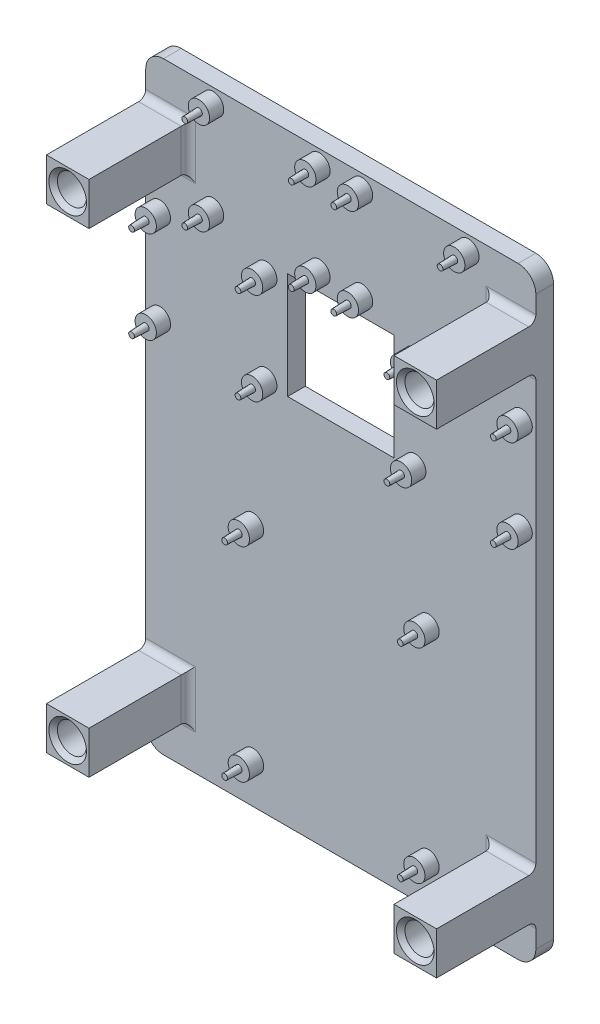
from build123d import *

# Parameters (mm, degrees)
SKIZZE1_W                                  = 110
SKIZZE1_H                                  = 170
AUFSATZ_LINEAR_AUSTRAGEN1_DEPTH            = 5
VERRUNDUNG1_R                              = 5
SKIZZE7_W                                  = 12
SKIZZE7_H                                  = 12
AUFSATZ_LINEAR_AUSTRAGEN3_DEPTH            = 28
VERRUNDUNG2_R                              = 2
SKIZZE8_R                                  = 4.1
SCHNITT_LINEAR_AUSTRAGEN3_DEPTH            = 107.484740691
LINEARES_MUSTER1_COUNT                     = 2
LINEARES_MUSTER1_PITCH                     = 134
LINEARES_MUSTER1_COUNT_DIR2                = 2
LINEARES_MUSTER1_PITCH_DIR2                = 98
SKIZZE9_R                                  = 3
AUFSATZ_LINEAR_AUSTRAGEN4_DEPTH            = 4
SKIZZE10_R                                 = 0.95
AUFSATZ_LINEAR_AUSTRAGEN5_DEPTH            = 4
AUFSATZ_LINEAR_AUSTRAGEN5_DRAFT            = 2
AUFSATZ_LINEAR_AUSTRAGEN5_PROFILE_2_DEPTH  = 4
AUFSATZ_LINEAR_AUSTRAGEN5_PROFILE_2_DRAFT  = 2
AUFSATZ_LINEAR_AUSTRAGEN5_PROFILE_3_DEPTH  = 4
AUFSATZ_LINEAR_AUSTRAGEN5_PROFILE_3_DRAFT  = 2
AUFSATZ_LINEAR_AUSTRAGEN5_PROFILE_4_DEPTH  = 4
AUFSATZ_LINEAR_AUSTRAGEN5_PROFILE_4_DRAFT  = 2
AUFSATZ_LINEAR_AUSTRAGEN5_PROFILE_5_DEPTH  = 4
AUFSATZ_LINEAR_AUSTRAGEN5_PROFILE_5_DRAFT  = 2
AUFSATZ_LINEAR_AUSTRAGEN5_PROFILE_6_DEPTH  = 4
AUFSATZ_LINEAR_AUSTRAGEN5_PROFILE_6_DRAFT  = 2
AUFSATZ_LINEAR_AUSTRAGEN5_PROFILE_7_DEPTH  = 4
AUFSATZ_LINEAR_AUSTRAGEN5_PROFILE_7_DRAFT  = 2
AUFSATZ_LINEAR_AUSTRAGEN5_PROFILE_8_DEPTH  = 4
AUFSATZ_LINEAR_AUSTRAGEN5_PROFILE_8_DRAFT  = 2
AUFSATZ_LINEAR_AUSTRAGEN5_PROFILE_9_DEPTH  = 4
AUFSATZ_LINEAR_AUSTRAGEN5_PROFILE_9_DRAFT  = 2
AUFSATZ_LINEAR_AUSTRAGEN5_PROFILE_10_DEPTH = 4
AUFSATZ_LINEAR_AUSTRAGEN5_PROFILE_10_DRAFT = 2
AUFSATZ_LINEAR_AUSTRAGEN5_PROFILE_11_DEPTH = 4
AUFSATZ_LINEAR_AUSTRAGEN5_PROFILE_11_DRAFT = 2
AUFSATZ_LINEAR_AUSTRAGEN5_PROFILE_12_DEPTH = 4
AUFSATZ_LINEAR_AUSTRAGEN5_PROFILE_12_DRAFT = 2
AUFSATZ_LINEAR_AUSTRAGEN5_PROFILE_13_DEPTH = 4
AUFSATZ_LINEAR_AUSTRAGEN5_PROFILE_13_DRAFT = 2
AUFSATZ_LINEAR_AUSTRAGEN5_PROFILE_14_DEPTH = 4
AUFSATZ_LINEAR_AUSTRAGEN5_PROFILE_14_DRAFT = 2
AUFSATZ_LINEAR_AUSTRAGEN5_PROFILE_15_DEPTH = 4
AUFSATZ_LINEAR_AUSTRAGEN5_PROFILE_15_DRAFT = 2
AUFSATZ_LINEAR_AUSTRAGEN5_PROFILE_16_DEPTH = 4
AUFSATZ_LINEAR_AUSTRAGEN5_PROFILE_16_DRAFT = 2
AUFSATZ_LINEAR_AUSTRAGEN5_PROFILE_17_DEPTH = 4
AUFSATZ_LINEAR_AUSTRAGEN5_PROFILE_17_DRAFT = 2
AUFSATZ_LINEAR_AUSTRAGEN5_PROFILE_18_DEPTH = 4
AUFSATZ_LINEAR_AUSTRAGEN5_PROFILE_18_DRAFT = 2
AUFSATZ_LINEAR_AUSTRAGEN5_PROFILE_19_DEPTH = 4
AUFSATZ_LINEAR_AUSTRAGEN5_PROFILE_19_DRAFT = 2
AUFSATZ_LINEAR_AUSTRAGEN5_PROFILE_20_DEPTH = 4
AUFSATZ_LINEAR_AUSTRAGEN5_PROFILE_20_DRAFT = 2
FASE1_SIZE                                 = 1.2
SKIZZE11_W                                 = 30
SKIZZE11_H                                 = 30
SCHNITT_LINEAR_AUSTRAGEN4_DEPTH            = 106.0428484


with BuildPart() as part:
    # Skizze1 → Aufsatz-Linear austragen1 (new body)
    with BuildSketch(Plane.XY):
        Rectangle(SKIZZE1_W, SKIZZE1_H)
    extrude(amount=AUFSATZ_LINEAR_AUSTRAGEN1_DEPTH)

    # Verrundung1
    verrundung1_edges = [part.edges().sort_by_distance(p)[0] for p in [
        (55, -85, 2.5),
        (-55, -85, 2.5),
        (-55, 85, 2.5),
        (55, 85, 2.5),
    ]]
    fillet(verrundung1_edges, radius=VERRUNDUNG1_R)

    # Skizze7 → Aufsatz-Linear austragen3 (add)
    with BuildSketch(Plane.XY.offset(5)):
        with Locations((-49, 67)):
            Rectangle(SKIZZE7_W, SKIZZE7_H)
        with Locations((49, 67)):
            Rectangle(SKIZZE7_W, SKIZZE7_H)
        with Locations((49, -67)):
            Rectangle(SKIZZE7_W, SKIZZE7_H)
        with Locations((-49, -67)):
            Rectangle(SKIZZE7_W, SKIZZE7_H)
    extrude(amount=AUFSATZ_LINEAR_AUSTRAGEN3_DEPTH)

    # Verrundung2
    verrundung2_edges = [part.edges().sort_by_distance(p)[0] for p in [
        (-49, 61, 5),
        (-43, 67, 5),
        (-49, 73, 5),
        (49, 73, 5),
        (43, 67, 5),
        (49, 61, 5),
        (49, -61, 5),
        (43, -67, 5),
        (49, -73, 5),
        (-49, -73, 5),
        (-43, -67, 5),
        (-49, -61, 5),
    ]]
    fillet(verrundung2_edges, radius=VERRUNDUNG2_R)

    # Skizze8 → Schnitt-Linear austragen3 (cut, through all)
    with BuildSketch(Plane.XY.offset(33)):
        with Locations((-49, 67)):
            Circle(SKIZZE8_R)
    schnitt_linear_austragen3 = extrude(amount=-SCHNITT_LINEAR_AUSTRAGEN3_DEPTH, mode=Mode.SUBTRACT)

    # Lineares Muster1: Schnitt-Linear austragen3 2 × 2
    with Locations(*[(j * LINEARES_MUSTER1_PITCH_DIR2, -i * LINEARES_MUSTER1_PITCH, 0) for i in range(LINEARES_MUSTER1_COUNT) for j in range(LINEARES_MUSTER1_COUNT_DIR2) if (i, j) != (0, 0)]):
        add(schnitt_linear_austragen3, mode=Mode.SUBTRACT)

    # Skizze9 → Aufsatz-Linear austragen4 (add)
    with BuildSketch(Plane.XY.offset(5)):
        with Locations(Location((24.75, -73.75, 0), (0, 0, 180))):
            Circle(SKIZZE9_R)
        with Locations(Location((24.75, -16.25, 0), (0, 0, 180))):
            Circle(SKIZZE9_R)
        with Locations(Location((-24.75, -16.25, 0), (0, 0, 180))):
            Circle(SKIZZE9_R)
        with Locations(Location((-24.75, -73.75, 0), (0, 0, 180))):
            Circle(SKIZZE9_R)
        with Locations(Location((-36, 81, 0), (0, 0, 180))):
            Circle(SKIZZE9_R)
        with Locations(Location((-6, 81, 0), (0, 0, 180))):
            Circle(SKIZZE9_R)
        with Locations(Location((-36, 55, 0), (0, 0, 180))):
            Circle(SKIZZE9_R)
        with Locations(Location((-6, 55, 0), (0, 0, 180))):
            Circle(SKIZZE9_R)
        with Locations(Location((6, 81, 0), (0, 0, 180))):
            Circle(SKIZZE9_R)
        with Locations(Location((36, 81, 0), (0, 0, 180))):
            Circle(SKIZZE9_R)
        with Locations(Location((36, 55, 0), (0, 0, 180))):
            Circle(SKIZZE9_R)
        with Locations(Location((6, 55, 0), (0, 0, 180))):
            Circle(SKIZZE9_R)
        with Locations(Location((21, 47, 0), (0, 0, 180))):
            Circle(SKIZZE9_R)
        with Locations(Location((51, 47, 0), (0, 0, 180))):
            Circle(SKIZZE9_R)
        with Locations(Location((51, 21, 0), (0, 0, 180))):
            Circle(SKIZZE9_R)
        with Locations(Location((21, 21, 0), (0, 0, 180))):
            Circle(SKIZZE9_R)
        with Locations(Location((-21, 47, 0), (0, 0, 180))):
            Circle(SKIZZE9_R)
        with Locations(Location((-51, 47, 0), (0, 0, 180))):
            Circle(SKIZZE9_R)
        with Locations(Location((-51, 21, 0), (0, 0, 180))):
            Circle(SKIZZE9_R)
        with Locations(Location((-21, 21, 0), (0, 0, 180))):
            Circle(SKIZZE9_R)
    extrude(amount=AUFSATZ_LINEAR_AUSTRAGEN4_DEPTH)


with BuildPart() as aufsatz_linear_austragen5_tool:
    # Skizze10 → Aufsatz-Linear austragen5 (with draft: the straight prism first)
    with BuildSketch(Plane.XY.offset(9)):
        with Locations((24.75, -73.75)):
            Circle(SKIZZE10_R)
    extrude(amount=AUFSATZ_LINEAR_AUSTRAGEN5_DEPTH)
    # Aufsatz-Linear austragen5: the draft: its side faces are tilted about the plane it starts from
    aufsatz_linear_austragen5_sides = [aufsatz_linear_austragen5_tool.faces().sort_by_distance(p)[0] for p in [
        (23.8, -73.75, 11),
    ]]
    draft(aufsatz_linear_austragen5_sides, Plane.XY.offset(9), AUFSATZ_LINEAR_AUSTRAGEN5_DRAFT)


with BuildPart() as part_1:
    add(part.part)

    # Aufsatz-Linear austragen5: add aufsatz_linear_austragen5_tool
    add(aufsatz_linear_austragen5_tool.part)


with BuildPart() as aufsatz_linear_austragen5_profile_2_tool:
    # Skizze10 → Aufsatz-Linear austragen5 profile 2 (with draft: the straight prism first)
    with BuildSketch(Plane.XY.offset(9)):
        with Locations((24.75, -16.25)):
            Circle(SKIZZE10_R)
    extrude(amount=AUFSATZ_LINEAR_AUSTRAGEN5_PROFILE_2_DEPTH)
    # Aufsatz-Linear austragen5 profile 2: the draft: its side faces are tilted about the plane it starts from
    aufsatz_linear_austragen5_profile_2_sides = [aufsatz_linear_austragen5_profile_2_tool.faces().sort_by_distance(p)[0] for p in [
        (23.8, -16.25, 11),
    ]]
    draft(aufsatz_linear_austragen5_profile_2_sides, Plane.XY.offset(9), AUFSATZ_LINEAR_AUSTRAGEN5_PROFILE_2_DRAFT)


with BuildPart() as part_2:
    add(part_1.part)

    # Aufsatz-Linear austragen5 profile 2: add aufsatz_linear_austragen5_profile_2_tool
    add(aufsatz_linear_austragen5_profile_2_tool.part)


with BuildPart() as aufsatz_linear_austragen5_profile_3_tool:
    # Skizze10 → Aufsatz-Linear austragen5 profile 3 (with draft: the straight prism first)
    with BuildSketch(Plane.XY.offset(9)):
        with Locations((-24.75, -16.25)):
            Circle(SKIZZE10_R)
    extrude(amount=AUFSATZ_LINEAR_AUSTRAGEN5_PROFILE_3_DEPTH)
    # Aufsatz-Linear austragen5 profile 3: the draft: its side faces are tilted about the plane it starts from
    aufsatz_linear_austragen5_profile_3_sides = [aufsatz_linear_austragen5_profile_3_tool.faces().sort_by_distance(p)[0] for p in [
        (-25.7, -16.25, 11),
    ]]
    draft(aufsatz_linear_austragen5_profile_3_sides, Plane.XY.offset(9), AUFSATZ_LINEAR_AUSTRAGEN5_PROFILE_3_DRAFT)


with BuildPart() as part_3:
    add(part_2.part)

    # Aufsatz-Linear austragen5 profile 3: add aufsatz_linear_austragen5_profile_3_tool
    add(aufsatz_linear_austragen5_profile_3_tool.part)


with BuildPart() as aufsatz_linear_austragen5_profile_4_tool:
    # Skizze10 → Aufsatz-Linear austragen5 profile 4 (with draft: the straight prism first)
    with BuildSketch(Plane.XY.offset(9)):
        with Locations((-24.75, -73.75)):
            Circle(SKIZZE10_R)
    extrude(amount=AUFSATZ_LINEAR_AUSTRAGEN5_PROFILE_4_DEPTH)
    # Aufsatz-Linear austragen5 profile 4: the draft: its side faces are tilted about the plane it starts from
    aufsatz_linear_austragen5_profile_4_sides = [aufsatz_linear_austragen5_profile_4_tool.faces().sort_by_distance(p)[0] for p in [
        (-25.7, -73.75, 11),
    ]]
    draft(aufsatz_linear_austragen5_profile_4_sides, Plane.XY.offset(9), AUFSATZ_LINEAR_AUSTRAGEN5_PROFILE_4_DRAFT)


with BuildPart() as part_4:
    add(part_3.part)

    # Aufsatz-Linear austragen5 profile 4: add aufsatz_linear_austragen5_profile_4_tool
    add(aufsatz_linear_austragen5_profile_4_tool.part)


with BuildPart() as aufsatz_linear_austragen5_profile_5_tool:
    # Skizze10 → Aufsatz-Linear austragen5 profile 5 (with draft: the straight prism first)
    with BuildSketch(Plane.XY.offset(9)):
        with Locations((-51, 47)):
            Circle(SKIZZE10_R)
    extrude(amount=AUFSATZ_LINEAR_AUSTRAGEN5_PROFILE_5_DEPTH)
    # Aufsatz-Linear austragen5 profile 5: the draft: its side faces are tilted about the plane it starts from
    aufsatz_linear_austragen5_profile_5_sides = [aufsatz_linear_austragen5_profile_5_tool.faces().sort_by_distance(p)[0] for p in [
        (-51.95, 47, 11),
    ]]
    draft(aufsatz_linear_austragen5_profile_5_sides, Plane.XY.offset(9), AUFSATZ_LINEAR_AUSTRAGEN5_PROFILE_5_DRAFT)


with BuildPart() as part_5:
    add(part_4.part)

    # Aufsatz-Linear austragen5 profile 5: add aufsatz_linear_austragen5_profile_5_tool
    add(aufsatz_linear_austragen5_profile_5_tool.part)


with BuildPart() as aufsatz_linear_austragen5_profile_6_tool:
    # Skizze10 → Aufsatz-Linear austragen5 profile 6 (with draft: the straight prism first)
    with BuildSketch(Plane.XY.offset(9)):
        with Locations((-51, 21)):
            Circle(SKIZZE10_R)
    extrude(amount=AUFSATZ_LINEAR_AUSTRAGEN5_PROFILE_6_DEPTH)
    # Aufsatz-Linear austragen5 profile 6: the draft: its side faces are tilted about the plane it starts from
    aufsatz_linear_austragen5_profile_6_sides = [aufsatz_linear_austragen5_profile_6_tool.faces().sort_by_distance(p)[0] for p in [
        (-51.95, 21, 11),
    ]]
    draft(aufsatz_linear_austragen5_profile_6_sides, Plane.XY.offset(9), AUFSATZ_LINEAR_AUSTRAGEN5_PROFILE_6_DRAFT)


with BuildPart() as part_6:
    add(part_5.part)

    # Aufsatz-Linear austragen5 profile 6: add aufsatz_linear_austragen5_profile_6_tool
    add(aufsatz_linear_austragen5_profile_6_tool.part)


with BuildPart() as aufsatz_linear_austragen5_profile_7_tool:
    # Skizze10 → Aufsatz-Linear austragen5 profile 7 (with draft: the straight prism first)
    with BuildSketch(Plane.XY.offset(9)):
        with Locations((-21, 21)):
            Circle(SKIZZE10_R)
    extrude(amount=AUFSATZ_LINEAR_AUSTRAGEN5_PROFILE_7_DEPTH)
    # Aufsatz-Linear austragen5 profile 7: the draft: its side faces are tilted about the plane it starts from
    aufsatz_linear_austragen5_profile_7_sides = [aufsatz_linear_austragen5_profile_7_tool.faces().sort_by_distance(p)[0] for p in [
        (-21.95, 21, 11),
    ]]
    draft(aufsatz_linear_austragen5_profile_7_sides, Plane.XY.offset(9), AUFSATZ_LINEAR_AUSTRAGEN5_PROFILE_7_DRAFT)


with BuildPart() as part_7:
    add(part_6.part)

    # Aufsatz-Linear austragen5 profile 7: add aufsatz_linear_austragen5_profile_7_tool
    add(aufsatz_linear_austragen5_profile_7_tool.part)


with BuildPart() as aufsatz_linear_austragen5_profile_8_tool:
    # Skizze10 → Aufsatz-Linear austragen5 profile 8 (with draft: the straight prism first)
    with BuildSketch(Plane.XY.offset(9)):
        with Locations((-21, 47)):
            Circle(SKIZZE10_R)
    extrude(amount=AUFSATZ_LINEAR_AUSTRAGEN5_PROFILE_8_DEPTH)
    # Aufsatz-Linear austragen5 profile 8: the draft: its side faces are tilted about the plane it starts from
    aufsatz_linear_austragen5_profile_8_sides = [aufsatz_linear_austragen5_profile_8_tool.faces().sort_by_distance(p)[0] for p in [
        (-21.95, 47, 11),
    ]]
    draft(aufsatz_linear_austragen5_profile_8_sides, Plane.XY.offset(9), AUFSATZ_LINEAR_AUSTRAGEN5_PROFILE_8_DRAFT)


with BuildPart() as part_8:
    add(part_7.part)

    # Aufsatz-Linear austragen5 profile 8: add aufsatz_linear_austragen5_profile_8_tool
    add(aufsatz_linear_austragen5_profile_8_tool.part)


with BuildPart() as aufsatz_linear_austragen5_profile_9_tool:
    # Skizze10 → Aufsatz-Linear austragen5 profile 9 (with draft: the straight prism first)
    with BuildSketch(Plane.XY.offset(9)):
        with Locations((-36, 55)):
            Circle(SKIZZE10_R)
    extrude(amount=AUFSATZ_LINEAR_AUSTRAGEN5_PROFILE_9_DEPTH)
    # Aufsatz-Linear austragen5 profile 9: the draft: its side faces are tilted about the plane it starts from
    aufsatz_linear_austragen5_profile_9_sides = [aufsatz_linear_austragen5_profile_9_tool.faces().sort_by_distance(p)[0] for p in [
        (-36.95, 55, 11),
    ]]
    draft(aufsatz_linear_austragen5_profile_9_sides, Plane.XY.offset(9), AUFSATZ_LINEAR_AUSTRAGEN5_PROFILE_9_DRAFT)


with BuildPart() as part_9:
    add(part_8.part)

    # Aufsatz-Linear austragen5 profile 9: add aufsatz_linear_austragen5_profile_9_tool
    add(aufsatz_linear_austragen5_profile_9_tool.part)


with BuildPart() as aufsatz_linear_austragen5_profile_10_tool:
    # Skizze10 → Aufsatz-Linear austragen5 profile 10 (with draft: the straight prism first)
    with BuildSketch(Plane.XY.offset(9)):
        with Locations((-6, 55)):
            Circle(SKIZZE10_R)
    extrude(amount=AUFSATZ_LINEAR_AUSTRAGEN5_PROFILE_10_DEPTH)
    # Aufsatz-Linear austragen5 profile 10: the draft: its side faces are tilted about the plane it starts from
    aufsatz_linear_austragen5_profile_10_sides = [aufsatz_linear_austragen5_profile_10_tool.faces().sort_by_distance(p)[0] for p in [
        (-6.95, 55, 11),
    ]]
    draft(aufsatz_linear_austragen5_profile_10_sides, Plane.XY.offset(9), AUFSATZ_LINEAR_AUSTRAGEN5_PROFILE_10_DRAFT)


with BuildPart() as part_10:
    add(part_9.part)

    # Aufsatz-Linear austragen5 profile 10: add aufsatz_linear_austragen5_profile_10_tool
    add(aufsatz_linear_austragen5_profile_10_tool.part)


with BuildPart() as aufsatz_linear_austragen5_profile_11_tool:
    # Skizze10 → Aufsatz-Linear austragen5 profile 11 (with draft: the straight prism first)
    with BuildSketch(Plane.XY.offset(9)):
        with Locations((6, 55)):
            Circle(SKIZZE10_R)
    extrude(amount=AUFSATZ_LINEAR_AUSTRAGEN5_PROFILE_11_DEPTH)
    # Aufsatz-Linear austragen5 profile 11: the draft: its side faces are tilted about the plane it starts from
    aufsatz_linear_austragen5_profile_11_sides = [aufsatz_linear_austragen5_profile_11_tool.faces().sort_by_distance(p)[0] for p in [
        (5.05, 55, 11),
    ]]
    draft(aufsatz_linear_austragen5_profile_11_sides, Plane.XY.offset(9), AUFSATZ_LINEAR_AUSTRAGEN5_PROFILE_11_DRAFT)


with BuildPart() as part_11:
    add(part_10.part)

    # Aufsatz-Linear austragen5 profile 11: add aufsatz_linear_austragen5_profile_11_tool
    add(aufsatz_linear_austragen5_profile_11_tool.part)


with BuildPart() as aufsatz_linear_austragen5_profile_12_tool:
    # Skizze10 → Aufsatz-Linear austragen5 profile 12 (with draft: the straight prism first)
    with BuildSketch(Plane.XY.offset(9)):
        with Locations((-36, 81)):
            Circle(SKIZZE10_R)
    extrude(amount=AUFSATZ_LINEAR_AUSTRAGEN5_PROFILE_12_DEPTH)
    # Aufsatz-Linear austragen5 profile 12: the draft: its side faces are tilted about the plane it starts from
    aufsatz_linear_austragen5_profile_12_sides = [aufsatz_linear_austragen5_profile_12_tool.faces().sort_by_distance(p)[0] for p in [
        (-36.95, 81, 11),
    ]]
    draft(aufsatz_linear_austragen5_profile_12_sides, Plane.XY.offset(9), AUFSATZ_LINEAR_AUSTRAGEN5_PROFILE_12_DRAFT)


with BuildPart() as part_12:
    add(part_11.part)

    # Aufsatz-Linear austragen5 profile 12: add aufsatz_linear_austragen5_profile_12_tool
    add(aufsatz_linear_austragen5_profile_12_tool.part)


with BuildPart() as aufsatz_linear_austragen5_profile_13_tool:
    # Skizze10 → Aufsatz-Linear austragen5 profile 13 (with draft: the straight prism first)
    with BuildSketch(Plane.XY.offset(9)):
        with Locations((-6, 81)):
            Circle(SKIZZE10_R)
    extrude(amount=AUFSATZ_LINEAR_AUSTRAGEN5_PROFILE_13_DEPTH)
    # Aufsatz-Linear austragen5 profile 13: the draft: its side faces are tilted about the plane it starts from
    aufsatz_linear_austragen5_profile_13_sides = [aufsatz_linear_austragen5_profile_13_tool.faces().sort_by_distance(p)[0] for p in [
        (-6.95, 81, 11),
    ]]
    draft(aufsatz_linear_austragen5_profile_13_sides, Plane.XY.offset(9), AUFSATZ_LINEAR_AUSTRAGEN5_PROFILE_13_DRAFT)


with BuildPart() as part_13:
    add(part_12.part)

    # Aufsatz-Linear austragen5 profile 13: add aufsatz_linear_austragen5_profile_13_tool
    add(aufsatz_linear_austragen5_profile_13_tool.part)


with BuildPart() as aufsatz_linear_austragen5_profile_14_tool:
    # Skizze10 → Aufsatz-Linear austragen5 profile 14 (with draft: the straight prism first)
    with BuildSketch(Plane.XY.offset(9)):
        with Locations((6, 81)):
            Circle(SKIZZE10_R)
    extrude(amount=AUFSATZ_LINEAR_AUSTRAGEN5_PROFILE_14_DEPTH)
    # Aufsatz-Linear austragen5 profile 14: the draft: its side faces are tilted about the plane it starts from
    aufsatz_linear_austragen5_profile_14_sides = [aufsatz_linear_austragen5_profile_14_tool.faces().sort_by_distance(p)[0] for p in [
        (5.05, 81, 11),
    ]]
    draft(aufsatz_linear_austragen5_profile_14_sides, Plane.XY.offset(9), AUFSATZ_LINEAR_AUSTRAGEN5_PROFILE_14_DRAFT)


with BuildPart() as part_14:
    add(part_13.part)

    # Aufsatz-Linear austragen5 profile 14: add aufsatz_linear_austragen5_profile_14_tool
    add(aufsatz_linear_austragen5_profile_14_tool.part)


with BuildPart() as aufsatz_linear_austragen5_profile_15_tool:
    # Skizze10 → Aufsatz-Linear austragen5 profile 15 (with draft: the straight prism first)
    with BuildSketch(Plane.XY.offset(9)):
        with Locations((36, 81)):
            Circle(SKIZZE10_R)
    extrude(amount=AUFSATZ_LINEAR_AUSTRAGEN5_PROFILE_15_DEPTH)
    # Aufsatz-Linear austragen5 profile 15: the draft: its side faces are tilted about the plane it starts from
    aufsatz_linear_austragen5_profile_15_sides = [aufsatz_linear_austragen5_profile_15_tool.faces().sort_by_distance(p)[0] for p in [
        (35.05, 81, 11),
    ]]
    draft(aufsatz_linear_austragen5_profile_15_sides, Plane.XY.offset(9), AUFSATZ_LINEAR_AUSTRAGEN5_PROFILE_15_DRAFT)


with BuildPart() as part_15:
    add(part_14.part)

    # Aufsatz-Linear austragen5 profile 15: add aufsatz_linear_austragen5_profile_15_tool
    add(aufsatz_linear_austragen5_profile_15_tool.part)


with BuildPart() as aufsatz_linear_austragen5_profile_16_tool:
    # Skizze10 → Aufsatz-Linear austragen5 profile 16 (with draft: the straight prism first)
    with BuildSketch(Plane.XY.offset(9)):
        with Locations((36, 55)):
            Circle(SKIZZE10_R)
    extrude(amount=AUFSATZ_LINEAR_AUSTRAGEN5_PROFILE_16_DEPTH)
    # Aufsatz-Linear austragen5 profile 16: the draft: its side faces are tilted about the plane it starts from
    aufsatz_linear_austragen5_profile_16_sides = [aufsatz_linear_austragen5_profile_16_tool.faces().sort_by_distance(p)[0] for p in [
        (35.05, 55, 11),
    ]]
    draft(aufsatz_linear_austragen5_profile_16_sides, Plane.XY.offset(9), AUFSATZ_LINEAR_AUSTRAGEN5_PROFILE_16_DRAFT)


with BuildPart() as part_16:
    add(part_15.part)

    # Aufsatz-Linear austragen5 profile 16: add aufsatz_linear_austragen5_profile_16_tool
    add(aufsatz_linear_austragen5_profile_16_tool.part)


with BuildPart() as aufsatz_linear_austragen5_profile_17_tool:
    # Skizze10 → Aufsatz-Linear austragen5 profile 17 (with draft: the straight prism first)
    with BuildSketch(Plane.XY.offset(9)):
        with Locations((21, 47)):
            Circle(SKIZZE10_R)
    extrude(amount=AUFSATZ_LINEAR_AUSTRAGEN5_PROFILE_17_DEPTH)
    # Aufsatz-Linear austragen5 profile 17: the draft: its side faces are tilted about the plane it starts from
    aufsatz_linear_austragen5_profile_17_sides = [aufsatz_linear_austragen5_profile_17_tool.faces().sort_by_distance(p)[0] for p in [
        (20.05, 47, 11),
    ]]
    draft(aufsatz_linear_austragen5_profile_17_sides, Plane.XY.offset(9), AUFSATZ_LINEAR_AUSTRAGEN5_PROFILE_17_DRAFT)


with BuildPart() as part_17:
    add(part_16.part)

    # Aufsatz-Linear austragen5 profile 17: add aufsatz_linear_austragen5_profile_17_tool
    add(aufsatz_linear_austragen5_profile_17_tool.part)


with BuildPart() as aufsatz_linear_austragen5_profile_18_tool:
    # Skizze10 → Aufsatz-Linear austragen5 profile 18 (with draft: the straight prism first)
    with BuildSketch(Plane.XY.offset(9)):
        with Locations((51, 47)):
            Circle(SKIZZE10_R)
    extrude(amount=AUFSATZ_LINEAR_AUSTRAGEN5_PROFILE_18_DEPTH)
    # Aufsatz-Linear austragen5 profile 18: the draft: its side faces are tilted about the plane it starts from
    aufsatz_linear_austragen5_profile_18_sides = [aufsatz_linear_austragen5_profile_18_tool.faces().sort_by_distance(p)[0] for p in [
        (50.05, 47, 11),
    ]]
    draft(aufsatz_linear_austragen5_profile_18_sides, Plane.XY.offset(9), AUFSATZ_LINEAR_AUSTRAGEN5_PROFILE_18_DRAFT)


with BuildPart() as part_18:
    add(part_17.part)

    # Aufsatz-Linear austragen5 profile 18: add aufsatz_linear_austragen5_profile_18_tool
    add(aufsatz_linear_austragen5_profile_18_tool.part)


with BuildPart() as aufsatz_linear_austragen5_profile_19_tool:
    # Skizze10 → Aufsatz-Linear austragen5 profile 19 (with draft: the straight prism first)
    with BuildSketch(Plane.XY.offset(9)):
        with Locations((21, 21)):
            Circle(SKIZZE10_R)
    extrude(amount=AUFSATZ_LINEAR_AUSTRAGEN5_PROFILE_19_DEPTH)
    # Aufsatz-Linear austragen5 profile 19: the draft: its side faces are tilted about the plane it starts from
    aufsatz_linear_austragen5_profile_19_sides = [aufsatz_linear_austragen5_profile_19_tool.faces().sort_by_distance(p)[0] for p in [
        (20.05, 21, 11),
    ]]
    draft(aufsatz_linear_austragen5_profile_19_sides, Plane.XY.offset(9), AUFSATZ_LINEAR_AUSTRAGEN5_PROFILE_19_DRAFT)


with BuildPart() as part_19:
    add(part_18.part)

    # Aufsatz-Linear austragen5 profile 19: add aufsatz_linear_austragen5_profile_19_tool
    add(aufsatz_linear_austragen5_profile_19_tool.part)


with BuildPart() as aufsatz_linear_austragen5_profile_20_tool:
    # Skizze10 → Aufsatz-Linear austragen5 profile 20 (with draft: the straight prism first)
    with BuildSketch(Plane.XY.offset(9)):
        with Locations((51, 21)):
            Circle(SKIZZE10_R)
    extrude(amount=AUFSATZ_LINEAR_AUSTRAGEN5_PROFILE_20_DEPTH)
    # Aufsatz-Linear austragen5 profile 20: the draft: its side faces are tilted about the plane it starts from
    aufsatz_linear_austragen5_profile_20_sides = [aufsatz_linear_austragen5_profile_20_tool.faces().sort_by_distance(p)[0] for p in [
        (50.05, 21, 11),
    ]]
    draft(aufsatz_linear_austragen5_profile_20_sides, Plane.XY.offset(9), AUFSATZ_LINEAR_AUSTRAGEN5_PROFILE_20_DRAFT)


with BuildPart() as part_20:
    add(part_19.part)

    # Aufsatz-Linear austragen5 profile 20: add aufsatz_linear_austragen5_profile_20_tool
    add(aufsatz_linear_austragen5_profile_20_tool.part)

    # Fase1
    fase1_edges = [part_20.edges().sort_by_distance(p)[0] for p in [
        (-53.1, 67, 33),
        (44.9, 67, 33),
        (-53.1, -67, 33),
        (44.9, -67, 33),
    ]]
    chamfer(fase1_edges, length=FASE1_SIZE)

    # Skizze11 → Schnitt-Linear austragen4 (cut, through all)
    with BuildSketch(Plane.XY.offset(5)):
        with Locations((0, 35)):
            Rectangle(SKIZZE11_W, SKIZZE11_H)
    extrude(amount=-SCHNITT_LINEAR_AUSTRAGEN4_DEPTH, mode=Mode.SUBTRACT)


solid = part_20.part
